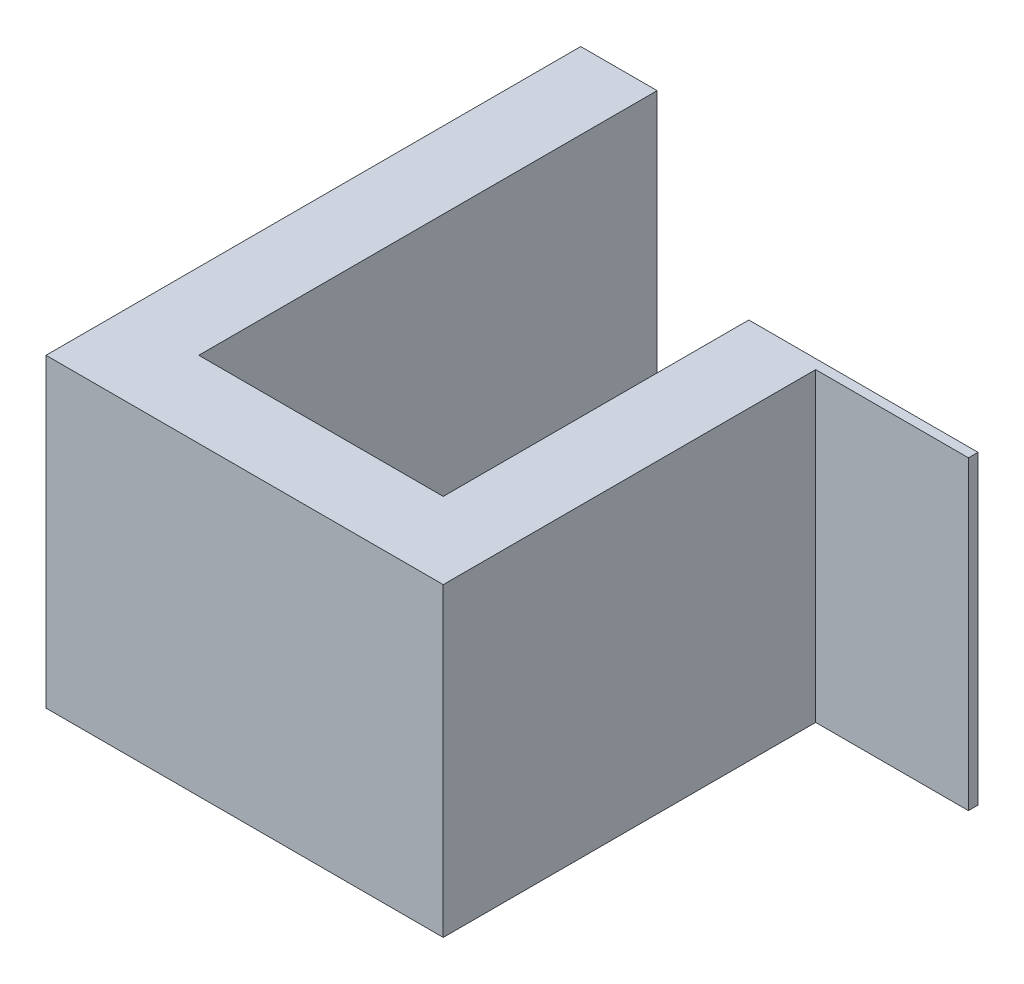
from build123d import *

# Parameters (mm, degrees)
SKETCH1_W           = 6.35
SKETCH1_H           = 0.396875
BOSS_EXTRUDE1_DEPTH = 12.7


with BuildPart() as part:
    # Sketch1 → Boss-Extrude1 (new body)
    with BuildSketch(Plane(origin=(0, 0, 0), x_dir=(1, 0, 0), z_dir=(0, 1, 0))):
        Polygon((-13.335, 6.35), (-13.335, -15.875), (0, -15.875), (0, -12.7), (-10.16, -12.7), (-10.16, 6.35), align=None)
        Polygon((0, -12.7), (0, -15.875), (3.175, -15.875), (3.175, -0.396875), (3.175, 0), (0, 0), align=None)
        with Locations((6.35, -0.1984375)):
            Rectangle(SKETCH1_W, SKETCH1_H)
    extrude(amount=BOSS_EXTRUDE1_DEPTH)


solid = part.part
